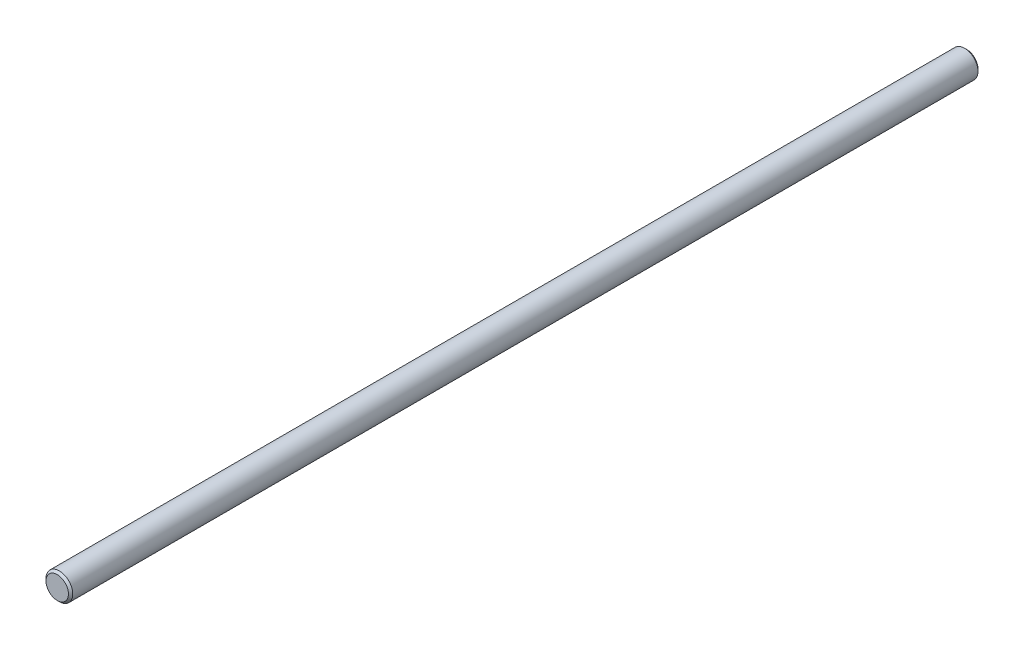
from build123d import *

# Parameters (mm, degrees)
SKIZZE1_R                       = 2.5
AUFSATZ_LINEAR_AUSTRAGEN1_DEPTH = 85
FASE1_SIZE                      = 0.4


with BuildPart() as part:
    # Skizze1 → Aufsatz-Linear austragen1 (new, symmetric)
    with BuildSketch(Plane.XY):
        Circle(SKIZZE1_R)
    extrude(amount=AUFSATZ_LINEAR_AUSTRAGEN1_DEPTH, both=True)

    # Fase1
    fase1_edges = [part.edges().sort_by_distance(p)[0] for p in [
        (-2.5, 0, -85),
        (-2.5, 0, 85),
    ]]
    chamfer(fase1_edges, length=FASE1_SIZE)


solid = part.part
